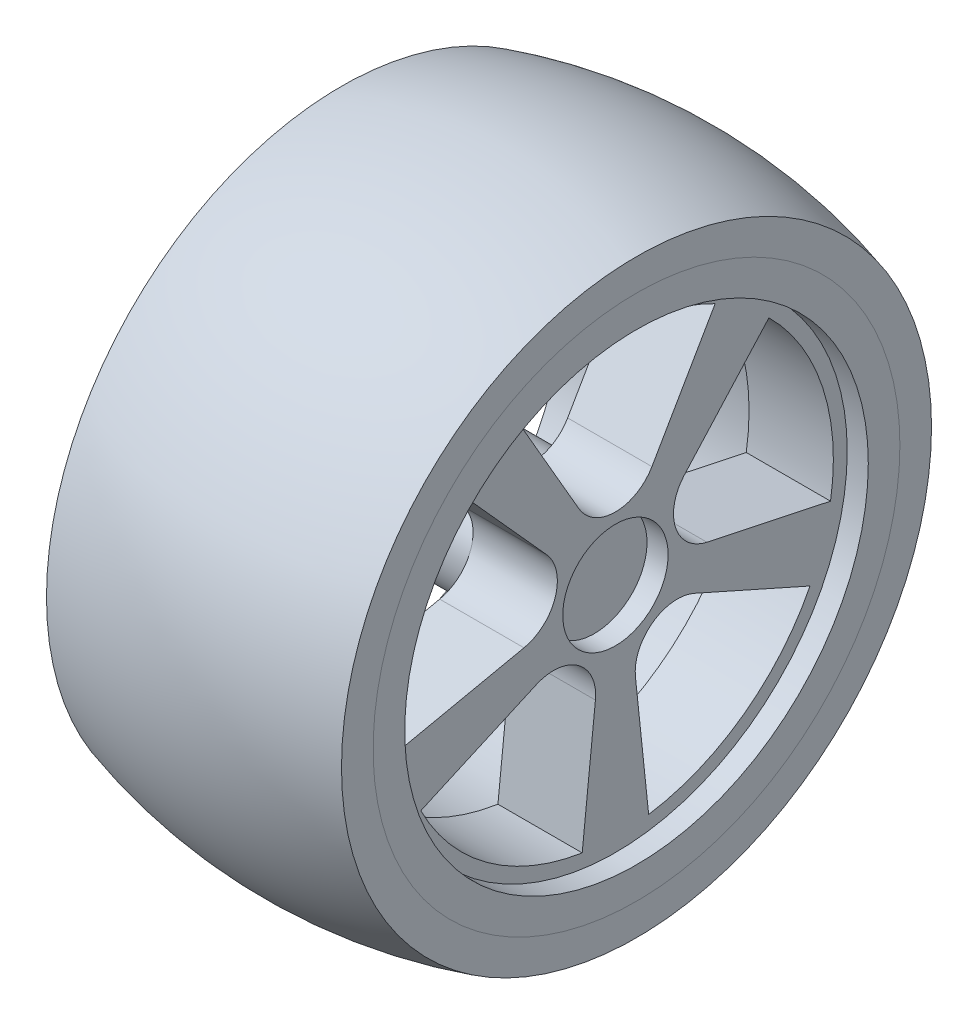
from build123d import *

# Parameters (mm, degrees)
SKETCH3_R          = 22
CUT_EXTRUDE1_DEPTH = 2
CUT_EXTRUDE2_DEPTH = 48.021271782
SKETCH4_R          = 5
CUT_EXTRUDE3_DEPTH = 2
CUT_EXTRUDE4_DEPTH = 7


with BuildPart() as part:
    # Sketch1 → Revolve1 (revolve)
    with BuildSketch(Plane.XY, mode=Mode.PRIVATE) as revolve1_sk:
        Polygon((0, 0), (-33, 0), (-33, 6), (-10, 6), (-10, 21), (-28, 21), (-28, 25), (-26, 25), (-26, 23), (-2, 23), (-2, 25), (0, 25), align=None)
    revolve(revolve1_sk.sketch.rotate(Axis((0, 0, 0), (-1, 0, 0)), 90), axis=Axis((0, 0, 0), (-1, 0, 0)))

    # Sketch3 → Cut-Extrude1 (cut)
    with BuildSketch(Plane(origin=(0, 0, 0), x_dir=(0, 0, -1), z_dir=(1, 0, 0))):
        Circle(SKETCH3_R)
    extrude(amount=-CUT_EXTRUDE1_DEPTH, mode=Mode.SUBTRACT)

    # Sketch2 → Cut-Extrude2 (cut, through all)
    with BuildSketch(Plane(origin=(-2, 0, 0), x_dir=(0, 0, -1), z_dir=(1, 0, 0))):
        with BuildLine():
            Line((-9.464163606, 18.392340636), (-3.464163606, 8.00003579))
            ThreePointArc((-3.464163606, 8.00003579), (0, 6), (3.464163606, 8.00003579))
            Line((3.464163606, 8.00003579), (9.464163606, 18.392340636))
            ThreePointArc((9.464163606, 18.392340636), (0, 20.684501126), (-9.464163606, 18.392340636))
        make_face()
        with BuildLine():
            Line((20.416742803, -3.317408646), (8.678971594, -0.822468356))
            ThreePointArc((8.678971594, -0.822468356), (5.706339098, 1.854101966), (6.538000743, 5.766762385))
            Line((6.538000743, 5.766762385), (14.56756802, 14.684500291))
            ThreePointArc((14.56756802, 14.684500291), (19.672129582, 6.391862368), (20.416742803, -3.317408646))
        make_face()
        with BuildLine():
            Line((3.154077386, -20.442611933), (1.899735827, -8.508349189))
            ThreePointArc((1.899735827, -8.508349189), (3.526711514, -4.854101966), (7.504870284, -4.435980631))
            Line((7.504870284, -4.435980631), (18.467415775, -9.316820348))
            ThreePointArc((18.467415775, -9.316820348), (12.158044713, -16.734112931), (3.154077386, -20.442611933))
        make_face()
        with BuildLine():
            Line((-18.467415775, -9.316820348), (-7.504870284, -4.435980631))
            ThreePointArc((-7.504870284, -4.435980631), (-3.526711514, -4.854101966), (-1.899735827, -8.508349189))
            Line((-1.899735827, -8.508349189), (-3.154077386, -20.442611933))
            ThreePointArc((-3.154077386, -20.442611933), (-12.158044713, -16.734112931), (-18.467415775, -9.316820348))
        make_face()
        with BuildLine():
            Line((-14.56756802, 14.684500291), (-6.538000743, 5.766762385))
            ThreePointArc((-6.538000743, 5.766762385), (-5.706339098, 1.854101966), (-8.678971594, -0.822468356))
            Line((-8.678971594, -0.822468356), (-20.416742803, -3.317408646))
            ThreePointArc((-20.416742803, -3.317408646), (-19.672129582, 6.391862368), (-14.56756802, 14.684500291))
        make_face()
    extrude(amount=-CUT_EXTRUDE2_DEPTH, mode=Mode.SUBTRACT)

    # Sketch4 → Cut-Extrude3 (cut)
    with BuildSketch(Plane(origin=(-2, 0, 0), x_dir=(0, 0, -1), z_dir=(1, 0, 0))):
        Circle(SKETCH4_R)
    extrude(amount=-CUT_EXTRUDE3_DEPTH, mode=Mode.SUBTRACT)

    # Sketch5 → Cut-Extrude4 (cut)
    with BuildSketch(Plane.ZY.offset(33)):
        with BuildLine():
            Line((-2.598076211, 1.5), (2.598076211, 1.5))
            ThreePointArc((2.598076211, 1.5), (3, 0), (2.598076211, -1.5))
            Line((2.598076211, -1.5), (-2.598076211, -1.5))
            ThreePointArc((-2.598076211, -1.5), (-3, 0), (-2.598076211, 1.5))
        make_face()
    extrude(amount=-CUT_EXTRUDE4_DEPTH, mode=Mode.SUBTRACT)


with BuildPart() as body_2:
    # Sketch7 → Revolve3 (revolve)
    with BuildSketch(Plane.XY, mode=Mode.PRIVATE) as revolve3_sk:
        with BuildLine():
            Line((-14, 26), (-24, 26))
            Line((-24, 26), (-24, 23))
            Line((-24, 23), (-26, 23))
            Line((-26, 23), (-26, 25))
            Line((-26, 25), (-28, 25))
            Line((-28, 25), (-28, 28))
            ThreePointArc((-28, 28), (-14, 30), (0, 28))
            Line((0, 28), (0, 25))
            Line((0, 25), (-2, 25))
            Line((-2, 25), (-2, 23))
            Line((-2, 23), (-4, 23))
            Line((-4, 23), (-4, 26))
            Line((-4, 26), (-14, 26))
        make_face()
    revolve(revolve3_sk.sketch.rotate(Axis((0, 0, 0), (-1, 0, 0)), 90), axis=Axis((0, 0, 0), (-1, 0, 0)))


solid = Compound([part.part, body_2.part])
